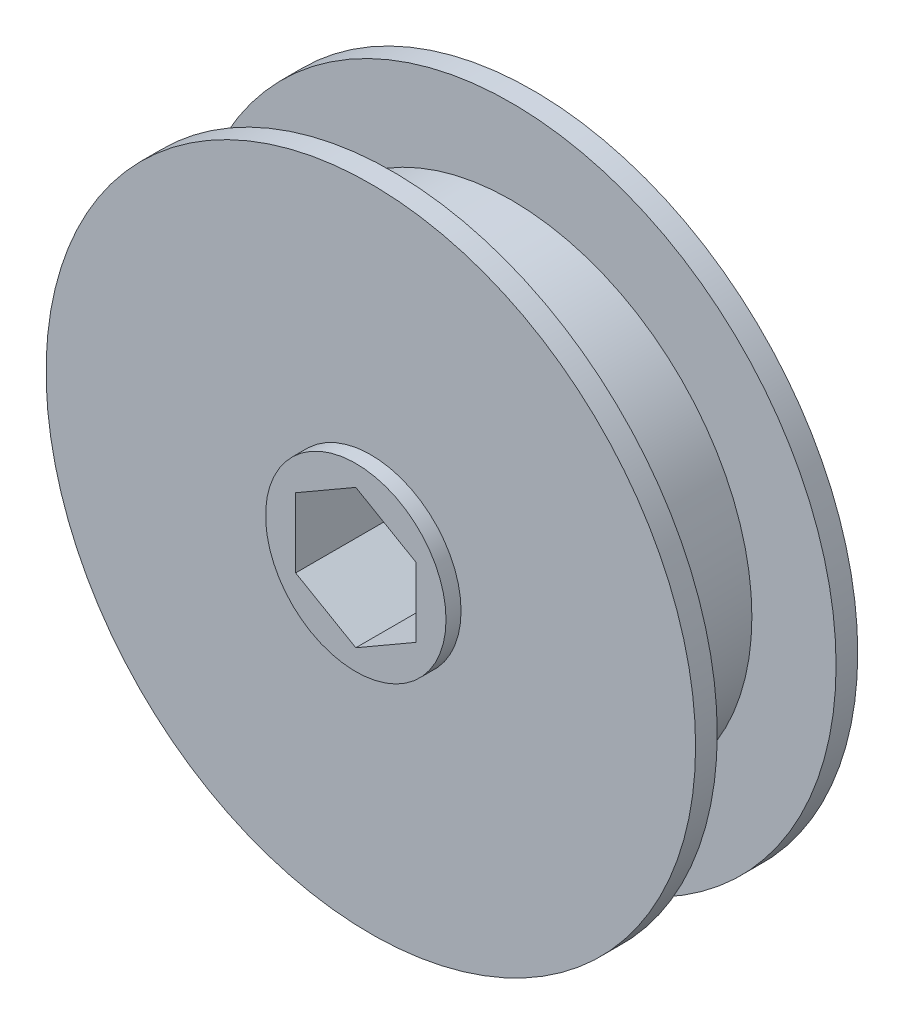
from build123d import *

# Parameters (mm, degrees)
SKETCH2_R           = 25.4
BOSS_EXTRUDE3_DEPTH = 8.21055
SKETCH3_R           = 34.29
BOSS_EXTRUDE4_DEPTH = 1.93675
SKETCH4_R           = 34.29
SKETCH4_R_2         = 9.525
CUT_EXTRUDE1_DEPTH  = 1.5875


with BuildPart() as part:
    # Sketch2 → Boss-Extrude3 (new, symmetric)
    with BuildSketch(Plane.XY):
        Circle(SKETCH2_R)
        Polygon((0, 7.332348419), (-6.35, 3.666174209), (-6.35, -3.666174209), (0, -7.332348419), (6.35, -3.666174209), (6.35, 3.666174209), align=None, mode=Mode.SUBTRACT)
    extrude(amount=BOSS_EXTRUDE3_DEPTH, both=True)

    # Sketch3 → Boss-Extrude4 (add, symmetric)
    with BuildSketch(Plane.XY.offset(8.21055)):
        Circle(SKETCH3_R)
        Polygon((0, 7.332348419), (-6.35, 3.666174209), (-6.35, -3.666174209), (0, -7.332348419), (6.35, -3.666174209), (6.35, 3.666174209), align=None, mode=Mode.SUBTRACT)
    boss_extrude4 = extrude(amount=BOSS_EXTRUDE4_DEPTH, both=True)

    # Sketch4 → Cut-Extrude1 (cut)
    with BuildSketch(Plane.XY.offset(10.1473)):
        Circle(SKETCH4_R)
        Circle(SKETCH4_R_2, mode=Mode.SUBTRACT)
    cut_extrude1 = extrude(amount=-CUT_EXTRUDE1_DEPTH, mode=Mode.SUBTRACT)

    # Mirror1: Boss-Extrude4, Cut-Extrude1 across plane
    add(boss_extrude4.mirror(Plane.XY))
    add(cut_extrude1.mirror(Plane.XY), mode=Mode.SUBTRACT)


solid = part.part
